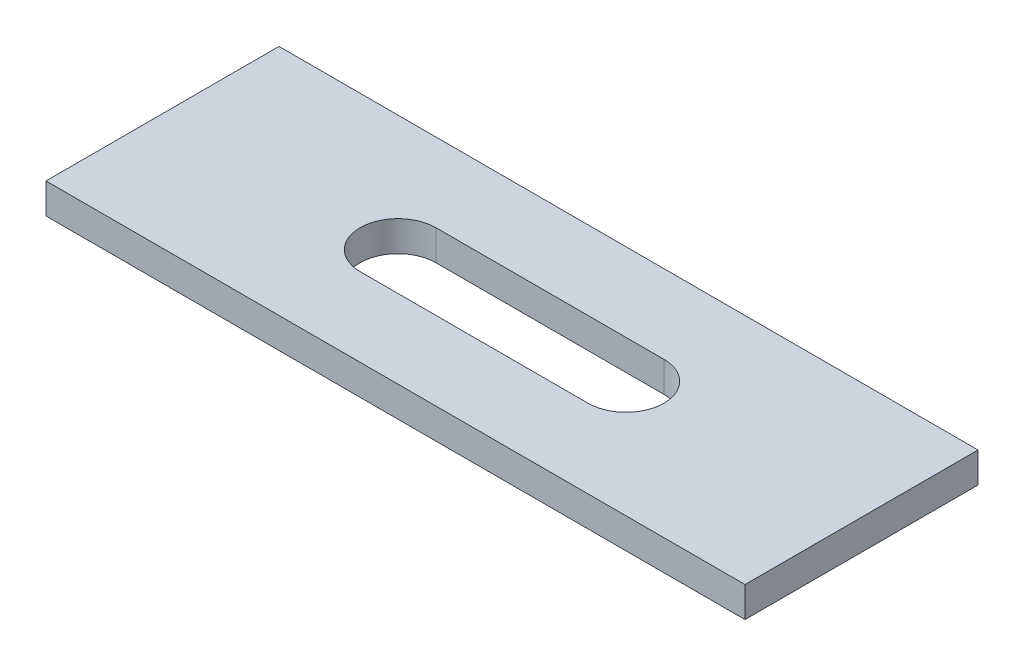
from build123d import *

# Parameters (mm, degrees)
SKETCH2_W           = 276
SKETCH2_H           = 92
BOSS_EXTRUDE1_DEPTH = 12
CUT_EXTRUDE1_DEPTH  = 12


with BuildPart() as part:
    # Sketch2 → Boss-Extrude1 (new body)
    with BuildSketch(Plane(origin=(0, 0, 0), x_dir=(1, 0, 0), z_dir=(0, 1, 0))):
        with Locations((138, 46)):
            Rectangle(SKETCH2_W, SKETCH2_H)
    extrude(amount=BOSS_EXTRUDE1_DEPTH)

    # Sketch2<3> → Cut-Extrude1 (cut)
    with BuildSketch(Plane(origin=(0, 0, 0), x_dir=(1, 0, 0), z_dir=(0, 1, 0))):
        with BuildLine():
            Line((93, 61), (183, 61))
            ThreePointArc((183, 61), (198, 46), (183, 31))
            Line((183, 31), (93, 31))
            ThreePointArc((93, 31), (78, 46), (93, 61))
        make_face()
    extrude(amount=CUT_EXTRUDE1_DEPTH, mode=Mode.SUBTRACT)


solid = part.part
